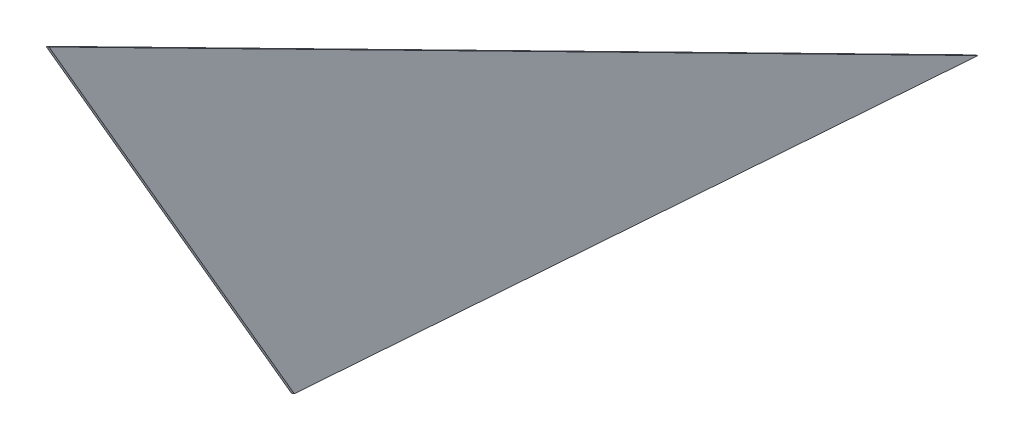
from build123d import *

# Parameters (mm, degrees)
BOSS_EXTRUDE2_DEPTH = 3.175


with BuildPart() as part:
    # Sketch8 → Boss-Extrude2 (new body)
    with BuildSketch(Plane(origin=(78.577912809, 27.826295435, 6.065092715), x_dir=(-0.06940269623355075, -0.021402649685502765, 0.9973591090183883), z_dir=(-0.9401547918941523, -0.33293102424216026, -0.07256652379389175))):
        Polygon((-589.018044977, -42.880791584), (111.73771639, 269.399557724), (-6.169899695, -29.657476107), align=None)
    extrude(amount=BOSS_EXTRUDE2_DEPTH)


solid = part.part
